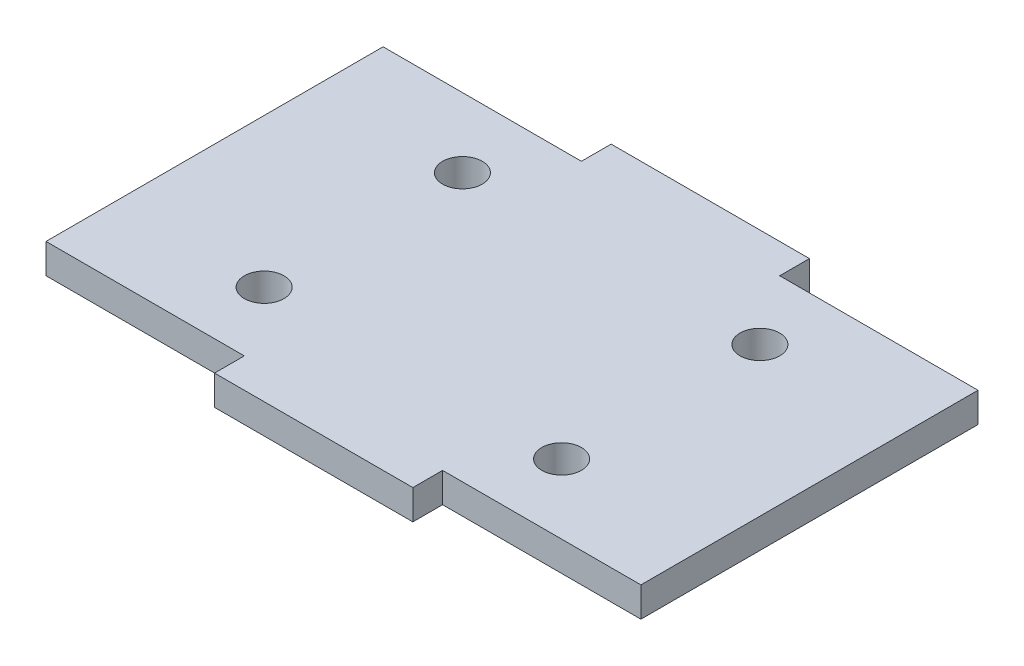
from build123d import *

# Parameters (mm, degrees)
SKETCH1_W           = 60
SKETCH1_H           = 40
BOSS_EXTRUDE1_DEPTH = 3
SKETCH2_W           = 20
SKETCH2_H           = 6
CUT_EXTRUDE1_DEPTH  = 3
SKETCH3_R           = 2
CUT_EXTRUDE2_DEPTH  = 3


with BuildPart() as part:
    # Sketch1 → Boss-Extrude1 (new body)
    with BuildSketch(Plane(origin=(0, 0, 0), x_dir=(1, 0, 0), z_dir=(0, 1, 0))):
        Rectangle(SKETCH1_W, SKETCH1_H)
    extrude(amount=BOSS_EXTRUDE1_DEPTH)

    # Sketch2 → Cut-Extrude1 (cut)
    with BuildSketch(Plane(origin=(0, 3, 0), x_dir=(1, 0, 0), z_dir=(0, 1, 0))):
        with Locations((-20, -20)):
            Rectangle(SKETCH2_W, SKETCH2_H)
        with Locations((20, -20)):
            Rectangle(SKETCH2_W, SKETCH2_H)
        with Locations((20, 20)):
            Rectangle(SKETCH2_W, SKETCH2_H)
        with Locations((-20, 20)):
            Rectangle(SKETCH2_W, SKETCH2_H)
    extrude(amount=-CUT_EXTRUDE1_DEPTH, mode=Mode.SUBTRACT)

    # Sketch3 → Cut-Extrude2 (cut)
    with BuildSketch(Plane(origin=(0, 3, 0), x_dir=(1, 0, 0), z_dir=(0, 1, 0))):
        with Locations(Location((-15, 10, 0), (0, 0, 270))):
            Circle(SKETCH3_R)
        with Locations(Location((-15, -10, 0), (0, 0, 90))):
            Circle(SKETCH3_R)
        with Locations(Location((15, -10, 0), (0, 0, 270))):
            Circle(SKETCH3_R)
        with Locations(Location((15, 10, 0), (0, 0, 90))):
            Circle(SKETCH3_R)
    extrude(amount=-CUT_EXTRUDE2_DEPTH, mode=Mode.SUBTRACT)


solid = part.part
